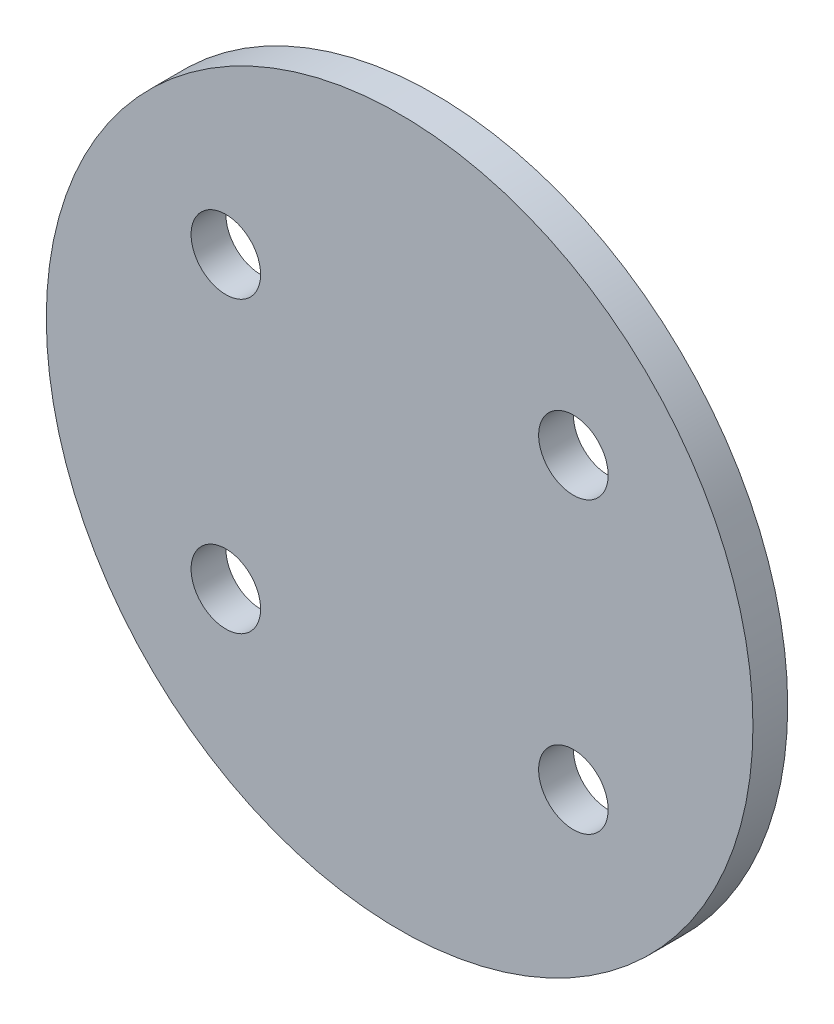
from build123d import *

# Parameters (mm, degrees)
MODEL_R             = 30.5
MODEL_R_2           = 3
BOSS_EXTRUDE1_DEPTH = 3


with BuildPart() as part:
    # Model → Boss-Extrude1 (new body)
    with BuildSketch(Plane.XY):
        Circle(MODEL_R)
        with Locations((15, 12.5)):
            Circle(MODEL_R_2, mode=Mode.SUBTRACT)
        with Locations((15, -12.5)):
            Circle(MODEL_R_2, mode=Mode.SUBTRACT)
        with Locations((-15, -12.5)):
            Circle(MODEL_R_2, mode=Mode.SUBTRACT)
        with Locations((-15, 12.5)):
            Circle(MODEL_R_2, mode=Mode.SUBTRACT)
    extrude(amount=BOSS_EXTRUDE1_DEPTH)


solid = part.part
